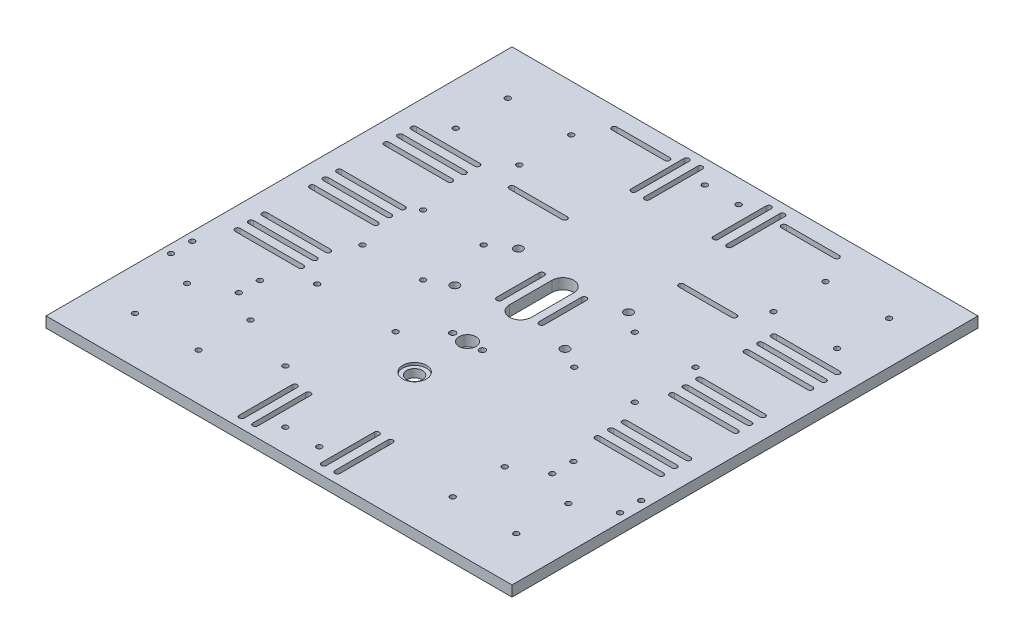
from build123d import *

# Parameters (mm, degrees)
SKETCH1_W           = 279.4
SKETCH1_H           = 279.4
BOSS_EXTRUDE1_DEPTH = 6.35
SKETCH2_R           = 7.112
CUT_EXTRUDE1_DEPTH  = 1.524
SKETCH3_R           = 4.7625
CUT_EXTRUDE2_DEPTH  = 198.624569009
SKETCH4_R           = 5.08
SKETCH4_R_2         = 2.54
SKETCH4_R_3         = 1.778
SKETCH4_R_4         = 1.5875
CUT_EXTRUDE3_DEPTH  = 198.667656687
SKETCH5_R           = 1.5875
CUT_EXTRUDE4_DEPTH  = 198.667656687
SKETCH6_R           = 1.5875
CUT_EXTRUDE5_DEPTH  = 198.667656687
SKETCH7_R           = 1.5875
CUT_EXTRUDE6_DEPTH  = 198.667656687
SKETCH8_R           = 1.5875
CUT_EXTRUDE7_DEPTH  = 198.667656687
CUT_EXTRUDE9_DEPTH  = 198.667656687


with BuildPart() as part:
    # Sketch1 → Boss-Extrude1 (new body)
    with BuildSketch(Plane(origin=(0, 0, 0), x_dir=(1, 0, 0), z_dir=(0, 1, 0))):
        Rectangle(SKETCH1_W, SKETCH1_H)
    extrude(amount=BOSS_EXTRUDE1_DEPTH)

    # Sketch2 → Cut-Extrude1 (cut)
    with BuildSketch(Plane(origin=(0, 6.35, 0), x_dir=(1, 0, 0), z_dir=(0, 1, 0))):
        with Locations(Location((0, -58.42, 0), (0, 0, 270))):
            Circle(SKETCH2_R)
    extrude(amount=-CUT_EXTRUDE1_DEPTH, mode=Mode.SUBTRACT)

    # Sketch3 → Cut-Extrude2 (cut, through all)
    with BuildSketch(Plane(origin=(0, 4.826, 0), x_dir=(1, 0, 0), z_dir=(0, 1, 0))):
        with Locations(Location((0, -58.42, 0), (0, 0, 270))):
            Circle(SKETCH3_R)
    extrude(amount=-CUT_EXTRUDE2_DEPTH, mode=Mode.SUBTRACT)

    # Sketch4 → Cut-Extrude3 (cut, through all)
    with BuildSketch(Plane(origin=(0, 6.35, 0), x_dir=(1, 0, 0), z_dir=(0, 1, 0))):
        with Locations(Location((0, -26.67, 0), (0, 0, 270))):
            Circle(SKETCH4_R)
        with Locations(Location((-33.02, 36.83, 0), (0, 0, 270))):
            Circle(SKETCH4_R_2)
        with Locations(Location((-33.02, -1.27, 0), (0, 0, 270))):
            Circle(SKETCH4_R_2)
        with Locations(Location((33.02, 36.83, 0), (0, 0, 270))):
            Circle(SKETCH4_R_2)
        with Locations(Location((33.02, -1.27, 0), (0, 0, 270))):
            Circle(SKETCH4_R_2)
        with Locations(Location((-8.89, -26.67, 0), (0, 0, 270))):
            Circle(SKETCH4_R_3)
        with Locations(Location((8.89, -26.67, 0), (0, 0, 270))):
            Circle(SKETCH4_R_3)
        with Locations(Location((-114.3, -111.76, 0), (0, 0, 270))):
            Circle(SKETCH4_R_4)
        with Locations(Location((-114.3, -80.56, 0), (0, 0, 270))):
            Circle(SKETCH4_R_4)
        with Locations(Location((-114.3, 80.56, 0), (0, 0, 270))):
            Circle(SKETCH4_R_4)
        with Locations(Location((-114.3, 111.76, 0), (0, 0, 270))):
            Circle(SKETCH4_R_4)
        with Locations(Location((-76.2, 111.76, 0), (0, 0, 270))):
            Circle(SKETCH4_R_4)
        with Locations(Location((-76.2, 80.56, 0), (0, 0, 270))):
            Circle(SKETCH4_R_4)
        with Locations(Location((-76.2, -80.56, 0), (0, 0, 270))):
            Circle(SKETCH4_R_4)
        with Locations(Location((76.2, 111.76, 0), (0, 0, 270))):
            Circle(SKETCH4_R_4)
        with Locations(Location((114.3, 111.76, 0), (0, 0, 270))):
            Circle(SKETCH4_R_4)
        with Locations(Location((114.3, 80.56, 0), (0, 0, 270))):
            Circle(SKETCH4_R_4)
        with Locations(Location((76.2, 80.56, 0), (0, 0, 270))):
            Circle(SKETCH4_R_4)
        with Locations(Location((76.2, -80.56, 0), (0, 0, 270))):
            Circle(SKETCH4_R_4)
        with Locations(Location((114.3, -80.56, 0), (0, 0, 270))):
            Circle(SKETCH4_R_4)
        with Locations(Location((76.2, -111.76, 0), (0, 0, 270))):
            Circle(SKETCH4_R_4)
        with Locations(Location((114.3, -111.76, 0), (0, 0, 270))):
            Circle(SKETCH4_R_4)
        with Locations(Location((-76.2, -111.76, 0), (0, 0, 270))):
            Circle(SKETCH4_R_4)
        with BuildLine():
            Line((6.5405, 30.48), (6.5405, 5.08))
            ThreePointArc((6.5405, 5.08), (0, -1.4605), (-6.5405, 5.08))
            Line((-6.5405, 5.08), (-6.5405, 30.48))
            ThreePointArc((-6.5405, 30.48), (0, 37.0205), (6.5405, 30.48))
        make_face()
        with BuildLine():
            Line((-11.1125, 30.48), (-11.1125, 5.08))
            ThreePointArc((-11.1125, 5.08), (-12.7, 3.4925), (-14.2875, 5.08))
            Line((-14.2875, 5.08), (-14.2875, 30.48))
            ThreePointArc((-14.2875, 30.48), (-12.7, 32.0675), (-11.1125, 30.48))
        make_face()
        with BuildLine():
            Line((14.2875, 30.48), (14.2875, 5.08))
            ThreePointArc((14.2875, 5.08), (12.7, 3.4925), (11.1125, 5.08))
            Line((11.1125, 5.08), (11.1125, 30.48))
            ThreePointArc((11.1125, 30.48), (12.7, 32.0675), (14.2875, 30.48))
        make_face()
    extrude(amount=-CUT_EXTRUDE3_DEPTH, mode=Mode.SUBTRACT)

    # Sketch5 → Cut-Extrude4 (cut, through all)
    with BuildSketch(Plane(origin=(0, 6.35, 0), x_dir=(1, 0, 0), z_dir=(0, 1, 0))):
        with Locations(Location((-134.62, -57.15, 0), (0, 0, 270))):
            Circle(SKETCH5_R)
        with Locations(Location((-134.62, -69.85, 0), (0, 0, 270))):
            Circle(SKETCH5_R)
        with Locations(Location((-93.98, -57.15, 0), (0, 0, 270))):
            Circle(SKETCH5_R)
        with Locations(Location((-93.98, -69.85, 0), (0, 0, 270))):
            Circle(SKETCH5_R)
        with Locations(Location((93.98, -57.15, 0), (0, 0, 270))):
            Circle(SKETCH5_R)
        with Locations(Location((93.98, -69.85, 0), (0, 0, 270))):
            Circle(SKETCH5_R)
        with Locations(Location((134.62, -57.15, 0), (0, 0, 270))):
            Circle(SKETCH5_R)
        with Locations(Location((134.62, -69.85, 0), (0, 0, 270))):
            Circle(SKETCH5_R)
    extrude(amount=-CUT_EXTRUDE4_DEPTH, mode=Mode.SUBTRACT)

    # Sketch6 → Cut-Extrude5 (cut, through all)
    with BuildSketch(Plane(origin=(0, 6.35, 0), x_dir=(1, 0, 0), z_dir=(0, 1, 0))):
        with Locations(Location((-10.16, 125.73, 0), (0, 0, 270))):
            Circle(SKETCH6_R)
        with Locations(Location((10.16, 125.73, 0), (0, 0, 270))):
            Circle(SKETCH6_R)
        with Locations(Location((-10.16, -125.73, 0), (0, 0, 270))):
            Circle(SKETCH6_R)
        with Locations(Location((10.16, -125.73, 0), (0, 0, 270))):
            Circle(SKETCH6_R)
    extrude(amount=-CUT_EXTRUDE5_DEPTH, mode=Mode.SUBTRACT)

    # Sketch7 → Cut-Extrude6 (cut, through all)
    with BuildSketch(Plane(origin=(0, 6.35, 0), x_dir=(1, 0, 0), z_dir=(0, 1, 0))):
        with Locations(Location((-81.675, 28.335, 0), (0, 0, 270))):
            Circle(SKETCH7_R)
        with Locations(Location((-81.675, -8.015, 0), (0, 0, 270))):
            Circle(SKETCH7_R)
        with Locations(Location((-45.325, -8.015, 0), (0, 0, 270))):
            Circle(SKETCH7_R)
        with Locations(Location((-45.325, 28.335, 0), (0, 0, 270))):
            Circle(SKETCH7_R)
        with Locations(Location((45.325, 28.335, 0), (0, 0, 270))):
            Circle(SKETCH7_R)
        with Locations(Location((45.325, -8.015, 0), (0, 0, 270))):
            Circle(SKETCH7_R)
        with Locations(Location((81.675, -8.015, 0), (0, 0, 270))):
            Circle(SKETCH7_R)
        with Locations(Location((81.675, 28.335, 0), (0, 0, 270))):
            Circle(SKETCH7_R)
    extrude(amount=-CUT_EXTRUDE6_DEPTH, mode=Mode.SUBTRACT)

    # Sketch8 → Cut-Extrude7 (cut, through all)
    with BuildSketch(Plane(origin=(0, 6.35, 0), x_dir=(1, 0, 0), z_dir=(0, 1, 0))):
        with Locations(Location((-41.91, -93.942117075, 0), (0, 0, 270))):
            Circle(SKETCH8_R)
        with Locations(Location((-26.67, -43.142117075, 0), (0, 0, 270))):
            Circle(SKETCH8_R)
        with Locations(Location((-74.93, -41.872117075, 0), (0, 0, 270))):
            Circle(SKETCH8_R)
    extrude(amount=-CUT_EXTRUDE7_DEPTH, mode=Mode.SUBTRACT)

    # Sketch9 → Cut-Extrude9 (cut, through all)
    with BuildSketch(Plane(origin=(0, 6.35, 0), x_dir=(1, 0, 0), z_dir=(0, 1, 0))):
        with BuildLine():
            Line((-127, 24.892), (-88.9, 24.892))
            ThreePointArc((-88.9, 24.892), (-87.376, 23.368), (-88.9, 21.844))
            Line((-88.9, 21.844), (-127, 21.844))
            ThreePointArc((-127, 21.844), (-128.524, 23.368), (-127, 24.892))
        make_face()
        with BuildLine():
            Line((-127, 16.764), (-88.9, 16.764))
            ThreePointArc((-88.9, 16.764), (-87.376, 15.24), (-88.9, 13.716))
            Line((-88.9, 13.716), (-127, 13.716))
            ThreePointArc((-127, 13.716), (-128.524, 15.24), (-127, 16.764))
        make_face()
        with BuildLine():
            Line((-127, 8.636), (-88.9, 8.636))
            ThreePointArc((-88.9, 8.636), (-87.376, 7.112), (-88.9, 5.588))
            Line((-88.9, 5.588), (-127, 5.588))
            ThreePointArc((-127, 5.588), (-128.524, 7.112), (-127, 8.636))
        make_face()
        with BuildLine():
            Line((-27.178, 133.35), (-27.178, 101.6))
            ThreePointArc((-27.178, 101.6), (-28.702, 100.076), (-30.226, 101.6))
            Line((-30.226, 101.6), (-30.226, 133.35))
            ThreePointArc((-30.226, 133.35), (-28.702, 134.874), (-27.178, 133.35))
        make_face()
        with BuildLine():
            Line((-19.05, 133.35), (-19.05, 101.6))
            ThreePointArc((-19.05, 101.6), (-20.574, 100.076), (-22.098, 101.6))
            Line((-22.098, 101.6), (-22.098, 133.35))
            ThreePointArc((-22.098, 133.35), (-20.574, 134.874), (-19.05, 133.35))
        make_face()
        with BuildLine():
            Line((-27.178, -101.6), (-27.178, -133.35))
            ThreePointArc((-27.178, -133.35), (-28.702, -134.874), (-30.226, -133.35))
            Line((-30.226, -133.35), (-30.226, -101.6))
            ThreePointArc((-30.226, -101.6), (-28.702, -100.076), (-27.178, -101.6))
        make_face()
        with BuildLine():
            Line((-19.05, -101.6), (-19.05, -133.35))
            ThreePointArc((-19.05, -133.35), (-20.574, -134.874), (-22.098, -133.35))
            Line((-22.098, -133.35), (-22.098, -101.6))
            ThreePointArc((-22.098, -101.6), (-20.574, -100.076), (-19.05, -101.6))
        make_face()
        with BuildLine():
            Line((-66.675, 129.54), (-34.925, 129.54))
            ThreePointArc((-34.925, 129.54), (-33.401, 128.016), (-34.925, 126.492))
            Line((-34.925, 126.492), (-66.675, 126.492))
            ThreePointArc((-66.675, 126.492), (-68.199, 128.016), (-66.675, 129.54))
        make_face()
        with BuildLine():
            Line((-66.675, 68.072), (-34.925, 68.072))
            ThreePointArc((-34.925, 68.072), (-33.401, 66.548), (-34.925, 65.024))
            Line((-34.925, 65.024), (-66.675, 65.024))
            ThreePointArc((-66.675, 65.024), (-68.199, 66.548), (-66.675, 68.072))
        make_face()
        with BuildLine():
            Line((-127, -19.812), (-88.9, -19.812))
            ThreePointArc((-88.9, -19.812), (-87.376, -21.336), (-88.9, -22.86))
            Line((-88.9, -22.86), (-127, -22.86))
            ThreePointArc((-127, -22.86), (-128.524, -21.336), (-127, -19.812))
        make_face()
        with BuildLine():
            Line((-127, -36.068), (-88.9, -36.068))
            ThreePointArc((-88.9, -36.068), (-87.376, -37.592), (-88.9, -39.116))
            Line((-88.9, -39.116), (-127, -39.116))
            ThreePointArc((-127, -39.116), (-128.524, -37.592), (-127, -36.068))
        make_face()
        with BuildLine():
            Line((-127, -27.94), (-88.9, -27.94))
            ThreePointArc((-88.9, -27.94), (-87.376, -29.464), (-88.9, -30.988))
            Line((-88.9, -30.988), (-127, -30.988))
            ThreePointArc((-127, -30.988), (-128.524, -29.464), (-127, -27.94))
        make_face()
        with BuildLine():
            Line((127, 24.892), (88.9, 24.892))
            ThreePointArc((88.9, 24.892), (87.376, 23.368), (88.9, 21.844))
            Line((88.9, 21.844), (127, 21.844))
            ThreePointArc((127, 21.844), (128.524, 23.368), (127, 24.892))
        make_face()
        with BuildLine():
            Line((127, 16.764), (88.9, 16.764))
            ThreePointArc((88.9, 16.764), (87.376, 15.24), (88.9, 13.716))
            Line((88.9, 13.716), (127, 13.716))
            ThreePointArc((127, 13.716), (128.524, 15.24), (127, 16.764))
        make_face()
        with BuildLine():
            Line((127, 8.636), (88.9, 8.636))
            ThreePointArc((88.9, 8.636), (87.376, 7.112), (88.9, 5.588))
            Line((88.9, 5.588), (127, 5.588))
            ThreePointArc((127, 5.588), (128.524, 7.112), (127, 8.636))
        make_face()
        with BuildLine():
            Line((27.178, 133.35), (27.178, 101.6))
            ThreePointArc((27.178, 101.6), (28.702, 100.076), (30.226, 101.6))
            Line((30.226, 101.6), (30.226, 133.35))
            ThreePointArc((30.226, 133.35), (28.702, 134.874), (27.178, 133.35))
        make_face()
        with BuildLine():
            Line((19.05, 133.35), (19.05, 101.6))
            ThreePointArc((19.05, 101.6), (20.574, 100.076), (22.098, 101.6))
            Line((22.098, 101.6), (22.098, 133.35))
            ThreePointArc((22.098, 133.35), (20.574, 134.874), (19.05, 133.35))
        make_face()
        with BuildLine():
            Line((27.178, -101.6), (27.178, -133.35))
            ThreePointArc((27.178, -133.35), (28.702, -134.874), (30.226, -133.35))
            Line((30.226, -133.35), (30.226, -101.6))
            ThreePointArc((30.226, -101.6), (28.702, -100.076), (27.178, -101.6))
        make_face()
        with BuildLine():
            Line((19.05, -101.6), (19.05, -133.35))
            ThreePointArc((19.05, -133.35), (20.574, -134.874), (22.098, -133.35))
            Line((22.098, -133.35), (22.098, -101.6))
            ThreePointArc((22.098, -101.6), (20.574, -100.076), (19.05, -101.6))
        make_face()
        with BuildLine():
            Line((66.675, 129.54), (34.925, 129.54))
            ThreePointArc((34.925, 129.54), (33.401, 128.016), (34.925, 126.492))
            Line((34.925, 126.492), (66.675, 126.492))
            ThreePointArc((66.675, 126.492), (68.199, 128.016), (66.675, 129.54))
        make_face()
        with BuildLine():
            Line((66.675, 68.072), (34.925, 68.072))
            ThreePointArc((34.925, 68.072), (33.401, 66.548), (34.925, 65.024))
            Line((34.925, 65.024), (66.675, 65.024))
            ThreePointArc((66.675, 65.024), (68.199, 66.548), (66.675, 68.072))
        make_face()
        with BuildLine():
            Line((-127, 69.596), (-88.9, 69.596))
            ThreePointArc((-88.9, 69.596), (-87.376, 68.072), (-88.9, 66.548))
            Line((-88.9, 66.548), (-127, 66.548))
            ThreePointArc((-127, 66.548), (-128.524, 68.072), (-127, 69.596))
        make_face()
        with BuildLine():
            Line((-127, 61.468), (-88.9, 61.468))
            ThreePointArc((-88.9, 61.468), (-87.376, 59.944), (-88.9, 58.42))
            Line((-88.9, 58.42), (-127, 58.42))
            ThreePointArc((-127, 58.42), (-128.524, 59.944), (-127, 61.468))
        make_face()
        with BuildLine():
            Line((-127, 53.34), (-88.9, 53.34))
            ThreePointArc((-88.9, 53.34), (-87.376, 51.816), (-88.9, 50.292))
            Line((-88.9, 50.292), (-127, 50.292))
            ThreePointArc((-127, 50.292), (-128.524, 51.816), (-127, 53.34))
        make_face()
        with BuildLine():
            Line((127, -19.812), (88.9, -19.812))
            ThreePointArc((88.9, -19.812), (87.376, -21.336), (88.9, -22.86))
            Line((88.9, -22.86), (127, -22.86))
            ThreePointArc((127, -22.86), (128.524, -21.336), (127, -19.812))
        make_face()
        with BuildLine():
            Line((127, -36.068), (88.9, -36.068))
            ThreePointArc((88.9, -36.068), (87.376, -37.592), (88.9, -39.116))
            Line((88.9, -39.116), (127, -39.116))
            ThreePointArc((127, -39.116), (128.524, -37.592), (127, -36.068))
        make_face()
        with BuildLine():
            Line((127, -27.94), (88.9, -27.94))
            ThreePointArc((88.9, -27.94), (87.376, -29.464), (88.9, -30.988))
            Line((88.9, -30.988), (127, -30.988))
            ThreePointArc((127, -30.988), (128.524, -29.464), (127, -27.94))
        make_face()
        with BuildLine():
            Line((127, 69.596), (88.9, 69.596))
            ThreePointArc((88.9, 69.596), (87.376, 68.072), (88.9, 66.548))
            Line((88.9, 66.548), (127, 66.548))
            ThreePointArc((127, 66.548), (128.524, 68.072), (127, 69.596))
        make_face()
        with BuildLine():
            Line((127, 61.468), (88.9, 61.468))
            ThreePointArc((88.9, 61.468), (87.376, 59.944), (88.9, 58.42))
            Line((88.9, 58.42), (127, 58.42))
            ThreePointArc((127, 58.42), (128.524, 59.944), (127, 61.468))
        make_face()
        with BuildLine():
            Line((127, 53.34), (88.9, 53.34))
            ThreePointArc((88.9, 53.34), (87.376, 51.816), (88.9, 50.292))
            Line((88.9, 50.292), (127, 50.292))
            ThreePointArc((127, 50.292), (128.524, 51.816), (127, 53.34))
        make_face()
    extrude(amount=-CUT_EXTRUDE9_DEPTH, mode=Mode.SUBTRACT)


solid = part.part
